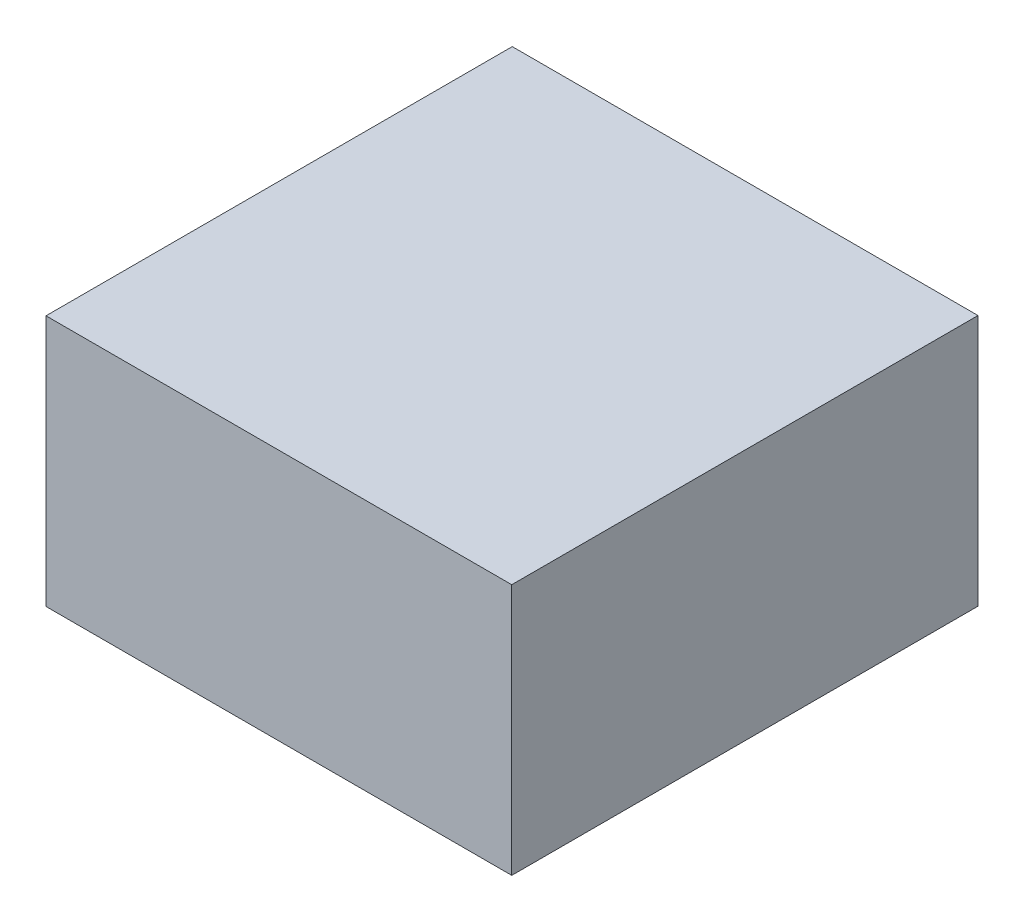
from build123d import *

# Parameters (mm, degrees)
SKETCH1_W           = 241.3
SKETCH1_H           = 117.602
BOSS_EXTRUDE1_DEPTH = 63.5
SKETCH2_W           = 123.825
SKETCH2_H           = 117.602
CUT_EXTRUDE1_DEPTH  = 276.840842523


with BuildPart() as part:
    # Sketch1 → Boss-Extrude1 (new body)
    with BuildSketch(Plane(origin=(0, 0, 0), x_dir=(1, 0, 0), z_dir=(0, 1, 0))):
        with Locations((120.65, 58.801)):
            Rectangle(SKETCH1_W, SKETCH1_H)
    extrude(amount=BOSS_EXTRUDE1_DEPTH)

    # Sketch2 → Cut-Extrude1 (cut, through all)
    with BuildSketch(Plane(origin=(0, 63.5, 0), x_dir=(1, 0, 0), z_dir=(0, 1, 0))):
        with Locations((179.3875, 58.801)):
            Rectangle(SKETCH2_W, SKETCH2_H)
    extrude(amount=-CUT_EXTRUDE1_DEPTH, mode=Mode.SUBTRACT)


solid = part.part
